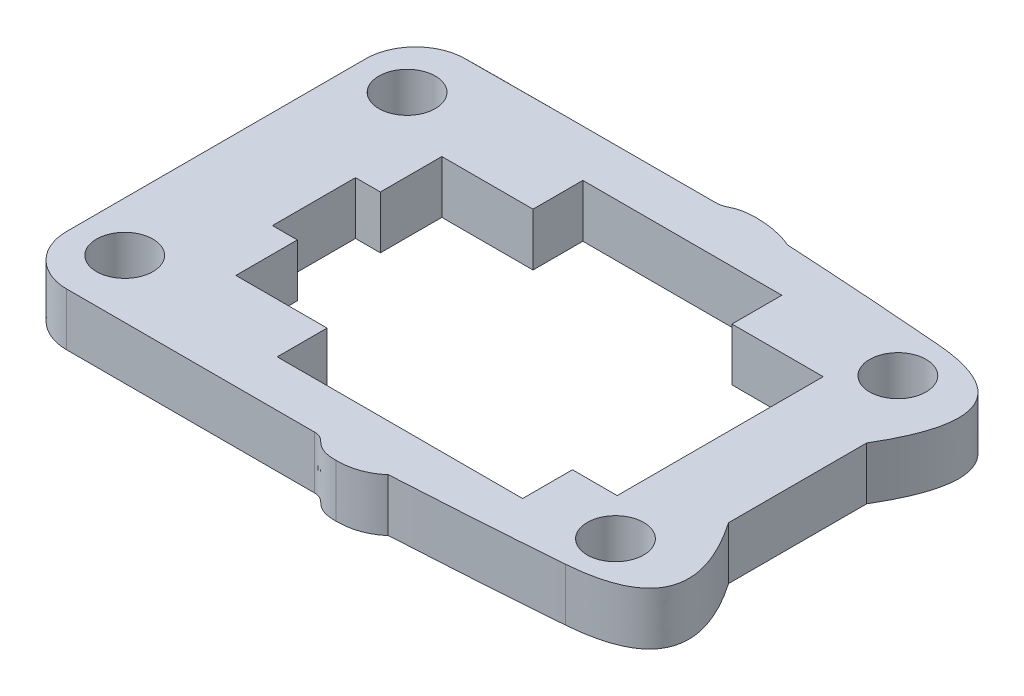
from build123d import *

# Parameters (mm, degrees)
SKETCH1_R           = 1.7
BOSS_EXTRUDE1_DEPTH = 3.175


with BuildPart() as part:
    # Sketch1 → Boss-Extrude1 (new body)
    with BuildSketch(Plane(origin=(0, 0, 0), x_dir=(1, 0, 0), z_dir=(0, 1, 0))):
        with BuildLine():
            Line((-8.136635094, -21.924266481), (-8.136635094, -3.923663686))
            add(Edge.make_bspline(
                [(-8.136635094, -3.923663686), (-8.136635094, -3.128086205), (-7.820964416, -2.365025621), (-7.259379446, -1.802237676)],
                knots=[1, 1, 1, 1, 2, 2, 2, 2], degree=3))
            add(Edge.make_bspline(
                [(-7.259379446, -1.802237676), (-6.697735984, -1.239635291), (-5.936245423, -0.92358316), (-5.141916572, -0.92358316)],
                knots=[2, 2, 2, 2, 3, 3, 3, 3], degree=3))
            add(Edge.make_bspline(
                [(-5.141916572, -0.92358316), (-5.154760404, -0.903039747), (4.165830441, -0.878716777), (9.879205527, -0.887994762)],
                knots=[3, 3, 3, 3, 4, 4, 4, 4], degree=3))
            add(Edge.make_bspline(
                [(9.879205527, -0.887994762), (10.624976408, -0.889274148), (10.564154649, -0.451680408), (11.906649469, -0.451680408)],
                knots=[4, 4, 4, 4, 5, 5, 5, 5], degree=3))
            add(Edge.make_bspline(
                [(11.906649469, -0.451680408), (13.315966334, -0.451680408), (14.214756726, -0.909055789), (14.223632862, -0.923583161)],
                knots=[5, 5, 5, 5, 6, 6, 6, 6], degree=3))
            add(Edge.make_bspline(
                [(14.223632862, -0.923583161), (19.256657746, -1.206420105), (23.971643033, -1.588653571)],
                knots=[6, 6, 6, 7, 7, 7], degree=2))
            add(Edge.make_bspline(
                [(23.971643033, -1.588653571), (30.995498409, -2.158356056), (26.975559396, -8.867814209)],
                knots=[7, 7, 7, 8, 8, 8], degree=2))
            Line((26.975559396, -8.867814209), (26.975559396, -17.1873007))
            add(Edge.make_bspline(
                [(26.975559396, -17.1873007), (31.442656292, -23.689574114), (24.231731846, -24.259083715)],
                knots=[9, 9, 9, 10, 10, 10], degree=2))
            add(Edge.make_bspline(
                [(24.231731846, -24.259083715), (19.39082339, -24.641510065), (14.223632861, -24.924217604)],
                knots=[10, 10, 10, 11, 11, 11], degree=2))
            add(Edge.make_bspline(
                [(14.223632861, -24.924217604), (13.297697384, -25.752946792), (11.906649468, -25.752946792)],
                knots=[11, 11, 11, 12, 12, 12], degree=2))
            add(Edge.make_bspline(
                [(11.906649468, -25.752946792), (10.398617885, -25.752946792), (10.590032411, -24.924217604), (9.791165568, -24.924217604)],
                knots=[12, 12, 12, 12, 13, 13, 13, 13], degree=3))
            add(Edge.make_bspline(
                [(9.791165568, -24.924217604), (4.074534437, -24.924217604), (-5.141916573, -24.924217603)],
                knots=[13, 13, 13, 14, 14, 14], degree=2))
            add(Edge.make_bspline(
                [(-5.141916573, -24.924217603), (-5.936245424, -24.924217603), (-6.697735984, -24.608292434), (-7.259379446, -24.045694932)],
                knots=[14, 14, 14, 14, 15, 15, 15, 15], degree=3))
            add(Edge.make_bspline(
                [(-7.259379446, -24.045694932), (-7.820964416, -23.483094989), (-8.136635094, -22.71984152), (-8.136635094, -21.924266481)],
                knots=[15, 15, 15, 15, 16, 16, 16, 16], degree=3))
        make_face()
        with Locations(Location((-5.141916573, -4.423727567, 0), (0, 0, 270))):
            Circle(SKETCH1_R, mode=Mode.SUBTRACT)
        with Locations(Location((24.40576455, -4.423727568, 0), (0, 0, 270))):
            Circle(SKETCH1_R, mode=Mode.SUBTRACT)
        with Locations(Location((-5.141916573, -21.42420016, 0), (0, 0, 270))):
            Circle(SKETCH1_R, mode=Mode.SUBTRACT)
        with Locations(Location((24.40576455, -21.42420016, 0), (0, 0, 270))):
            Circle(SKETCH1_R, mode=Mode.SUBTRACT)
        Polygon((-2.246994867, -15.424170952), (-0.749638043, -15.424170952), (-0.749638043, -19.12426571), (4.740444467, -19.12426571), (4.740444467, -22.124153352), (19.514384952, -22.124153352), (19.514384952, -19.12426571), (22.209527799, -19.12426571), (22.209527799, -6.723857342), (16.719255189, -6.723857342), (16.719255189, -3.723713335), (4.740444467, -3.723713335), (4.740444467, -6.723857342), (-0.749638043, -6.723857342), (-0.749638043, -10.4239521), (-2.246994867, -10.4239521), align=None, mode=Mode.SUBTRACT)
    extrude(amount=BOSS_EXTRUDE1_DEPTH)


solid = part.part
